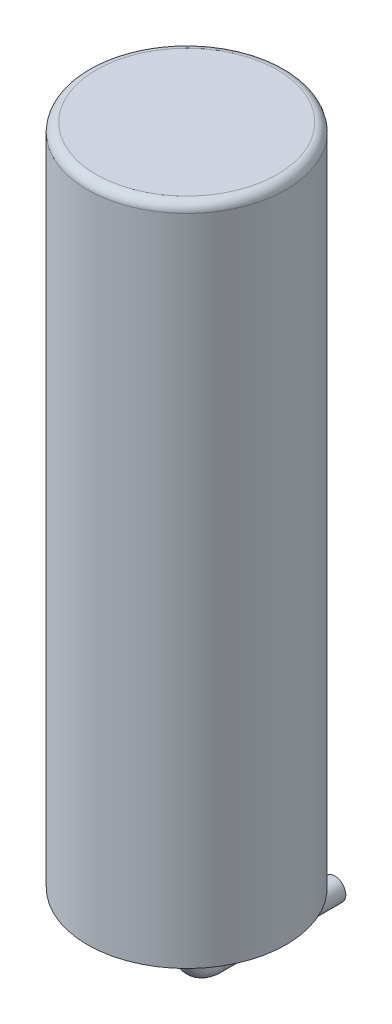
from build123d import *

# Parameters (mm, degrees)
SKETCH1_R           = 2.25
BOSS_EXTRUDE1_DEPTH = 15
SKETCH2_R           = 0.25
SKETCH4_R           = 0.1
FILLET1_R           = 0.2


with BuildPart() as part:
    # Sketch1 → Boss-Extrude1 (new body)
    with BuildSketch(Plane(origin=(0, 0, 0), x_dir=(1, 0, 0), z_dir=(0, 1, 0))):
        with Locations(Location((0, 0, 0), (0, 0, 270))):
            Circle(SKETCH1_R)
    extrude(amount=BOSS_EXTRUDE1_DEPTH)

    # Sweep1: sweep along a path in Sketch3
    with BuildLine(Plane(origin=(0, 0, 0), x_dir=(0, 0, -1), z_dir=(1, 0, 0))) as sweep1_path:
        Line((0, 0), (0, -1.1))
        ThreePointArc((0, -1.1), (0.175735931, -1.524264069), (0.6, -1.7))
        Line((0.6, -1.7), (3.35, -1.7))
    # Sketch2 → Sweep1 (sweep)
    with BuildSketch(Plane.XZ):
        Circle(SKETCH2_R)
    sweep(path=sweep1_path.line)

    # Sweep2: sweep along a path in Sketch5
    with BuildLine(Plane(origin=(0, 0, 0), x_dir=(0, 0, -1), z_dir=(1, 0, 0))) as sweep2_path:
        Line((0, 0), (0, -1.1))
        ThreePointArc((0, -1.1), (0.175735931, -1.524264069), (0.6, -1.7))
        Line((0.6, -1.7), (1.1, -1.7))
    # Sketch4 → Sweep2 (sweep)
    with BuildSketch(Plane.XZ):
        with Locations((-1.125, 0)):
            Circle(SKETCH4_R)
    sweep(path=sweep2_path.line)

    # Fillet1
    fillet1_edges = [part.edges().sort_by_distance(p)[0] for p in [
        (0, 15, -2.25),
    ]]
    fillet(fillet1_edges, radius=FILLET1_R)


solid = part.part
